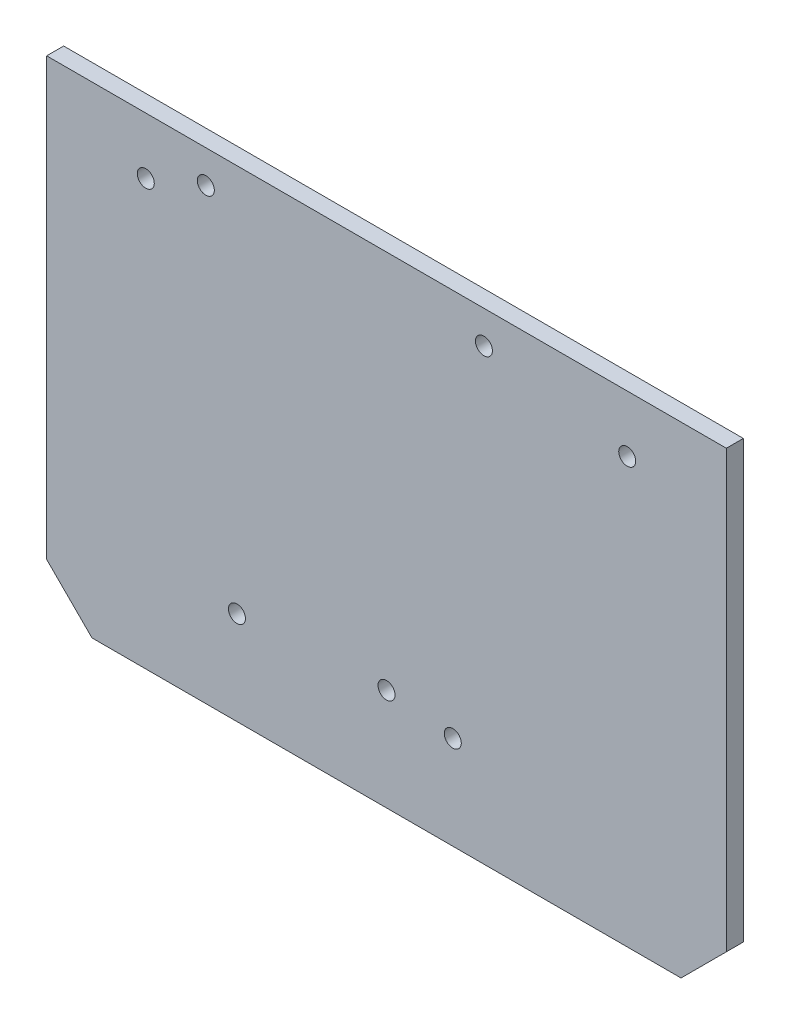
from build123d import *

# Parameters (mm, degrees)
SKETCH_1_W          = 120
SKETCH_1_H          = 85
EXTRUDE_1_DEPTH     = 3
SKETCH_2_R          = 1.5
CUT_EXTRUDE_1_DEPTH = 74.588382235
CHAMFER_1_SIZE      = 8
SKETCH_3_R          = 1.5
CUT_EXTRUDE_2_DEPTH = 74.588382235


with BuildPart() as part:
    # 草图1 → 凸台-拉伸1 (new body)
    with BuildSketch(Plane.XY):
        Rectangle(SKETCH_1_W, SKETCH_1_H)
    extrude(amount=EXTRUDE_1_DEPTH)

    # 草图2 → 切除-拉伸1 (cut, through all)
    with BuildSketch(Plane.XY.offset(3)):
        with Locations((0, -24.5)):
            Circle(SKETCH_2_R)
        with Locations((-42.5, 32.5)):
            Circle(SKETCH_2_R)
        with Locations(Location((42.5, 32.5, 0), (0, 0, 180))):
            Circle(SKETCH_2_R)
    extrude(amount=-CUT_EXTRUDE_1_DEPTH, mode=Mode.SUBTRACT)

    # 倒角1
    chamfer_1_edges = [part.edges().sort_by_distance(p)[0] for p in [
        (60, -42.5, 1.5),
        (-60, -42.5, 1.5),
    ]]
    chamfer(chamfer_1_edges, length=CHAMFER_1_SIZE)

    # 草图3 → 切除-拉伸2 (cut, through all)
    with BuildSketch(Plane.XY.offset(3)):
        with Locations((-31.900458771, 36.737548565)):
            Circle(SKETCH_3_R)
        with Locations((-26.400458771, -26)):
            Circle(SKETCH_3_R)
        with Locations(Location((11.699541229, -26, 0), (0, 0, 180))):
            Circle(SKETCH_3_R)
        with Locations(Location((17.199541229, 36.737548565, 0), (0, 0, 180))):
            Circle(SKETCH_3_R)
    extrude(amount=-CUT_EXTRUDE_2_DEPTH, mode=Mode.SUBTRACT)


solid = part.part
